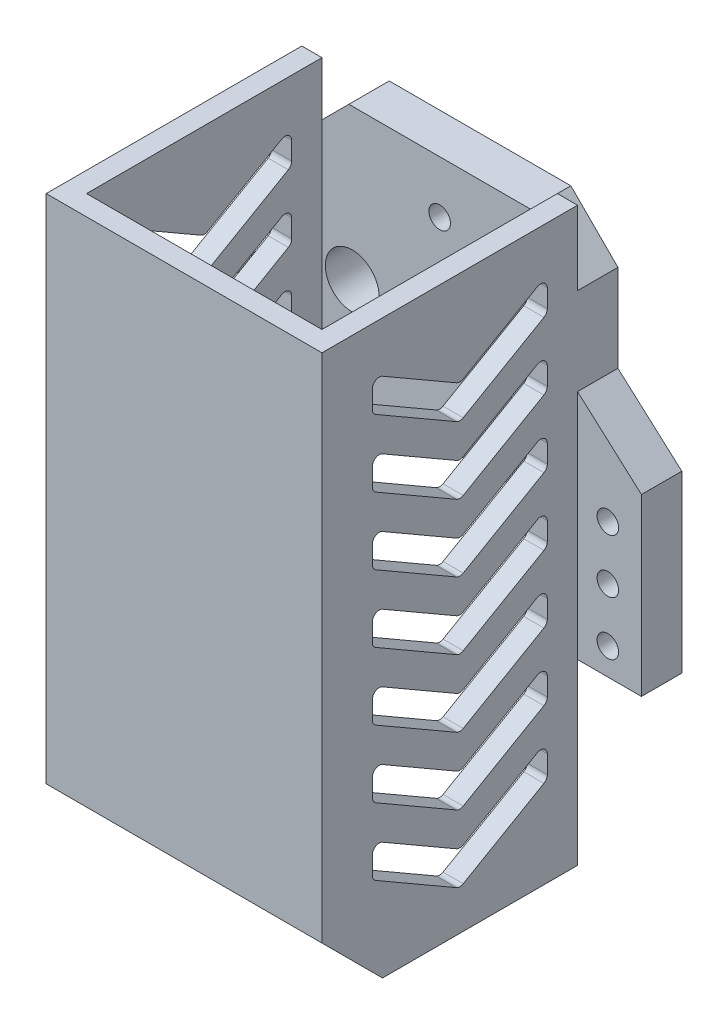
from build123d import *

# Parameters (mm, degrees)
SKETCH_1_R          = 1.6
SKETCH_1_R_2        = 4
EXTRUDE_1_DEPTH     = 6
SKETCH_2_W          = 3
SKETCH_2_H          = 85
EXTRUDE_2_DEPTH     = 35
CUT_EXTRUDE_2_DEPTH = 128.793779191
SKETCH_7_R          = 3
CUT_EXTRUDE_4_DEPTH = 3
SKETCH_8_W          = 41
SKETCH_8_H          = 85
EXTRUDE_3_DEPTH     = 3
CUT_EXTRUDE_5_REACH = 130.788


with BuildPart() as part:
    # 草图1 → 凸台-拉伸1 (new body)
    with BuildSketch(Plane.XY):
        Polygon((-30, -83.5), (-17.5, -83.5), (-17.5, -66), (17.5, -66), (17.5, -83.5), (30, -83.5), (30, -57.5), (20.5, -49), (20.5, -36), (13.5, -29), (-13.5, -29), (-20.5, -36), (-20.5, -49), (-30, -57.5), align=None)
        with Locations((-25, -63.5)):
            Circle(SKETCH_1_R, mode=Mode.SUBTRACT)
        with Locations((-25, -71.5)):
            Circle(SKETCH_1_R, mode=Mode.SUBTRACT)
        with Locations((-25, -79.5)):
            Circle(SKETCH_1_R, mode=Mode.SUBTRACT)
        with Locations((25, -63.5)):
            Circle(SKETCH_1_R, mode=Mode.SUBTRACT)
        with Locations((25, -71.5)):
            Circle(SKETCH_1_R, mode=Mode.SUBTRACT)
        with Locations((25, -79.5)):
            Circle(SKETCH_1_R, mode=Mode.SUBTRACT)
        with Locations((13, -51.5)):
            Circle(SKETCH_1_R_2, mode=Mode.SUBTRACT)
        with Locations((-13, -51.5)):
            Circle(SKETCH_1_R_2, mode=Mode.SUBTRACT)
        with Locations((-10, -60.5)):
            Circle(SKETCH_1_R, mode=Mode.SUBTRACT)
        with Locations((10, -60.5)):
            Circle(SKETCH_1_R, mode=Mode.SUBTRACT)
        with Locations((0, -36.8)):
            Circle(SKETCH_1_R, mode=Mode.SUBTRACT)
    extrude(amount=EXTRUDE_1_DEPTH)

    # 草图2 → 凸台-拉伸2 (add)
    with BuildSketch(Plane.XY.offset(6)):
        with Locations((-19, -67.5)):
            Rectangle(SKETCH_2_W, SKETCH_2_H)
        with Locations((19, -67.5)):
            Rectangle(SKETCH_2_W, SKETCH_2_H)
    extrude(amount=EXTRUDE_2_DEPTH)

    # 草图5 → 切除-拉伸2 (cut, through all)
    with BuildSketch(Plane(origin=(20.5, 0, 0), x_dir=(0, 0, -1), z_dir=(1, 0, 0))):
        with BuildLine():
            Line((-36, -96.937822174), (-24, -103.866025404))
            ThreePointArc((-24, -103.866025404), (-23.5, -104), (-23, -103.866025404))
            Line((-23, -103.866025404), (-11, -96.937822174))
            ThreePointArc((-11, -96.937822174), (-10.633974596, -96.57179677), (-10.5, -96.07179677))
            Line((-10.5, -96.07179677), (-10.5, -93.381197846))
            ThreePointArc((-10.5, -93.381197846), (-11, -92.515172443), (-12, -92.515172443))
            Line((-12, -92.515172443), (-23, -98.866025404))
            ThreePointArc((-23, -98.866025404), (-23.5, -99), (-24, -98.866025404))
            Line((-24, -98.866025404), (-35, -92.515172443))
            ThreePointArc((-35, -92.515172443), (-36, -92.515172443), (-36.5, -93.381197846))
            Line((-36.5, -93.381197846), (-36.5, -96.07179677))
            ThreePointArc((-36.5, -96.07179677), (-36.366025404, -96.57179677), (-36, -96.937822174))
        make_face()
        with BuildLine():
            Line((-36, -86.937822174), (-24, -93.866025404))
            ThreePointArc((-24, -93.866025404), (-23.5, -94), (-23, -93.866025404))
            Line((-23, -93.866025404), (-11, -86.937822174))
            ThreePointArc((-11, -86.937822174), (-10.633974596, -86.57179677), (-10.5, -86.07179677))
            Line((-10.5, -86.07179677), (-10.5, -83.381197846))
            ThreePointArc((-10.5, -83.381197846), (-11, -82.515172443), (-12, -82.515172443))
            Line((-12, -82.515172443), (-23, -88.866025404))
            ThreePointArc((-23, -88.866025404), (-23.5, -89), (-24, -88.866025404))
            Line((-24, -88.866025404), (-35, -82.515172443))
            ThreePointArc((-35, -82.515172443), (-36, -82.515172443), (-36.5, -83.381197846))
            Line((-36.5, -83.381197846), (-36.5, -86.07179677))
            ThreePointArc((-36.5, -86.07179677), (-36.366025404, -86.57179677), (-36, -86.937822174))
        make_face()
        with BuildLine():
            Line((-36, -76.937822174), (-24, -83.866025404))
            ThreePointArc((-24, -83.866025404), (-23.5, -84), (-23, -83.866025404))
            Line((-23, -83.866025404), (-11, -76.937822174))
            ThreePointArc((-11, -76.937822174), (-10.633974596, -76.57179677), (-10.5, -76.07179677))
            Line((-10.5, -76.07179677), (-10.5, -73.381197846))
            ThreePointArc((-10.5, -73.381197846), (-11, -72.515172443), (-12, -72.515172443))
            Line((-12, -72.515172443), (-23, -78.866025404))
            ThreePointArc((-23, -78.866025404), (-23.5, -79), (-24, -78.866025404))
            Line((-24, -78.866025404), (-35, -72.515172443))
            ThreePointArc((-35, -72.515172443), (-36, -72.515172443), (-36.5, -73.381197846))
            Line((-36.5, -73.381197846), (-36.5, -76.07179677))
            ThreePointArc((-36.5, -76.07179677), (-36.366025404, -76.57179677), (-36, -76.937822174))
        make_face()
        with BuildLine():
            Line((-36, -66.937822174), (-24, -73.866025404))
            ThreePointArc((-24, -73.866025404), (-23.5, -74), (-23, -73.866025404))
            Line((-23, -73.866025404), (-11, -66.937822174))
            ThreePointArc((-11, -66.937822174), (-10.633974596, -66.57179677), (-10.5, -66.07179677))
            Line((-10.5, -66.07179677), (-10.5, -63.381197846))
            ThreePointArc((-10.5, -63.381197846), (-11, -62.515172443), (-12, -62.515172443))
            Line((-12, -62.515172443), (-23, -68.866025404))
            ThreePointArc((-23, -68.866025404), (-23.5, -69), (-24, -68.866025404))
            Line((-24, -68.866025404), (-35, -62.515172443))
            ThreePointArc((-35, -62.515172443), (-36, -62.515172443), (-36.5, -63.381197846))
            Line((-36.5, -63.381197846), (-36.5, -66.07179677))
            ThreePointArc((-36.5, -66.07179677), (-36.366025404, -66.57179677), (-36, -66.937822174))
        make_face()
        with BuildLine():
            Line((-36, -56.937822174), (-24, -63.866025404))
            ThreePointArc((-24, -63.866025404), (-23.5, -64), (-23, -63.866025404))
            Line((-23, -63.866025404), (-11, -56.937822174))
            ThreePointArc((-11, -56.937822174), (-10.633974596, -56.57179677), (-10.5, -56.07179677))
            Line((-10.5, -56.07179677), (-10.5, -53.381197846))
            ThreePointArc((-10.5, -53.381197846), (-11, -52.515172443), (-12, -52.515172443))
            Line((-12, -52.515172443), (-23, -58.866025404))
            ThreePointArc((-23, -58.866025404), (-23.5, -59), (-24, -58.866025404))
            Line((-24, -58.866025404), (-35, -52.515172443))
            ThreePointArc((-35, -52.515172443), (-36, -52.515172443), (-36.5, -53.381197846))
            Line((-36.5, -53.381197846), (-36.5, -56.07179677))
            ThreePointArc((-36.5, -56.07179677), (-36.366025404, -56.57179677), (-36, -56.937822174))
        make_face()
        with BuildLine():
            Line((-36, -46.937822174), (-24, -53.866025404))
            ThreePointArc((-24, -53.866025404), (-23.5, -54), (-23, -53.866025404))
            Line((-23, -53.866025404), (-11, -46.937822174))
            ThreePointArc((-11, -46.937822174), (-10.633974596, -46.57179677), (-10.5, -46.07179677))
            Line((-10.5, -46.07179677), (-10.5, -43.381197846))
            ThreePointArc((-10.5, -43.381197846), (-11, -42.515172443), (-12, -42.515172443))
            Line((-12, -42.515172443), (-23, -48.866025404))
            ThreePointArc((-23, -48.866025404), (-23.5, -49), (-24, -48.866025404))
            Line((-24, -48.866025404), (-35, -42.515172443))
            ThreePointArc((-35, -42.515172443), (-36, -42.515172443), (-36.5, -43.381197846))
            Line((-36.5, -43.381197846), (-36.5, -46.07179677))
            ThreePointArc((-36.5, -46.07179677), (-36.366025404, -46.57179677), (-36, -46.937822174))
        make_face()
        with BuildLine():
            Line((-36, -36.937822174), (-24, -43.866025404))
            ThreePointArc((-24, -43.866025404), (-23.5, -44), (-23, -43.866025404))
            Line((-23, -43.866025404), (-11, -36.937822174))
            ThreePointArc((-11, -36.937822174), (-10.633974596, -36.57179677), (-10.5, -36.07179677))
            Line((-10.5, -36.07179677), (-10.5, -33.381197846))
            ThreePointArc((-10.5, -33.381197846), (-11, -32.515172443), (-12, -32.515172443))
            Line((-12, -32.515172443), (-23, -38.866025404))
            ThreePointArc((-23, -38.866025404), (-23.5, -39), (-24, -38.866025404))
            Line((-24, -38.866025404), (-35, -32.515172443))
            ThreePointArc((-35, -32.515172443), (-36, -32.515172443), (-36.5, -33.381197846))
            Line((-36.5, -33.381197846), (-36.5, -36.07179677))
            ThreePointArc((-36.5, -36.07179677), (-36.366025404, -36.57179677), (-36, -36.937822174))
        make_face()
    extrude(amount=-CUT_EXTRUDE_2_DEPTH, mode=Mode.SUBTRACT)

    # 草图7 → 切除-拉伸4 (cut)
    with BuildSketch(Plane(origin=(0, 0, 0), x_dir=(-1, 0, 0), z_dir=(0, 0, -1))):
        with Locations((10, -60.5)):
            Circle(SKETCH_7_R)
        with Locations((-10, -60.5)):
            Circle(SKETCH_7_R)
        with Locations((0, -36.8)):
            Circle(SKETCH_7_R)
    extrude(amount=-CUT_EXTRUDE_4_DEPTH, mode=Mode.SUBTRACT)

    # 草图8 → 凸台-拉伸3 (add)
    with BuildSketch(Plane.XY.offset(41)):
        with Locations((0, -67.5)):
            Rectangle(SKETCH_8_W, SKETCH_8_H)
    extrude(amount=EXTRUDE_3_DEPTH)

    # 草图9 → 切除-拉伸5 (cut, up to next)
    with BuildSketch(Plane(origin=(20.5, 0, 0), x_dir=(0, 0, -1), z_dir=(1, 0, 0)), mode=Mode.PRIVATE) as cut_extrude_5_sk1:
        Polygon((-44, -110), (-44, -101), (-35, -110), align=None)
    cut_extrude_5_tool1 = extrude(cut_extrude_5_sk1.sketch, amount=-CUT_EXTRUDE_5_REACH, mode=Mode.PRIVATE) & part.part
    add(cut_extrude_5_tool1.solids().sort_by_distance((20.5, -107, 41))[0], mode=Mode.SUBTRACT)


solid = part.part
